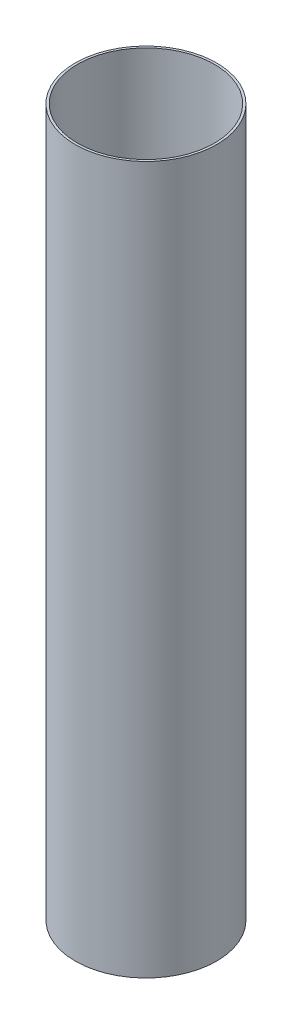
from build123d import *

# Parameters (mm, degrees)
SKETCH1_R           = 31
BOSS_EXTRUDE1_DEPTH = 310
SKETCH2_R           = 30
CUT_EXTRUDE1_DEPTH  = 300


with BuildPart() as part:
    # Sketch1 → Boss-Extrude1 (new body)
    with BuildSketch(Plane(origin=(0, 0, 0), x_dir=(1, 0, 0), z_dir=(0, 1, 0))):
        with Locations(Location((0, 0, 0), (0, 0, 270))):
            Circle(SKETCH1_R)
    extrude(amount=BOSS_EXTRUDE1_DEPTH)

    # Sketch2 → Cut-Extrude1 (cut)
    with BuildSketch(Plane(origin=(0, 310, 0), x_dir=(1, 0, 0), z_dir=(0, 1, 0))):
        with Locations(Location((0, 0, 0), (0, 0, 270))):
            Circle(SKETCH2_R)
    extrude(amount=-CUT_EXTRUDE1_DEPTH, mode=Mode.SUBTRACT)


solid = part.part
